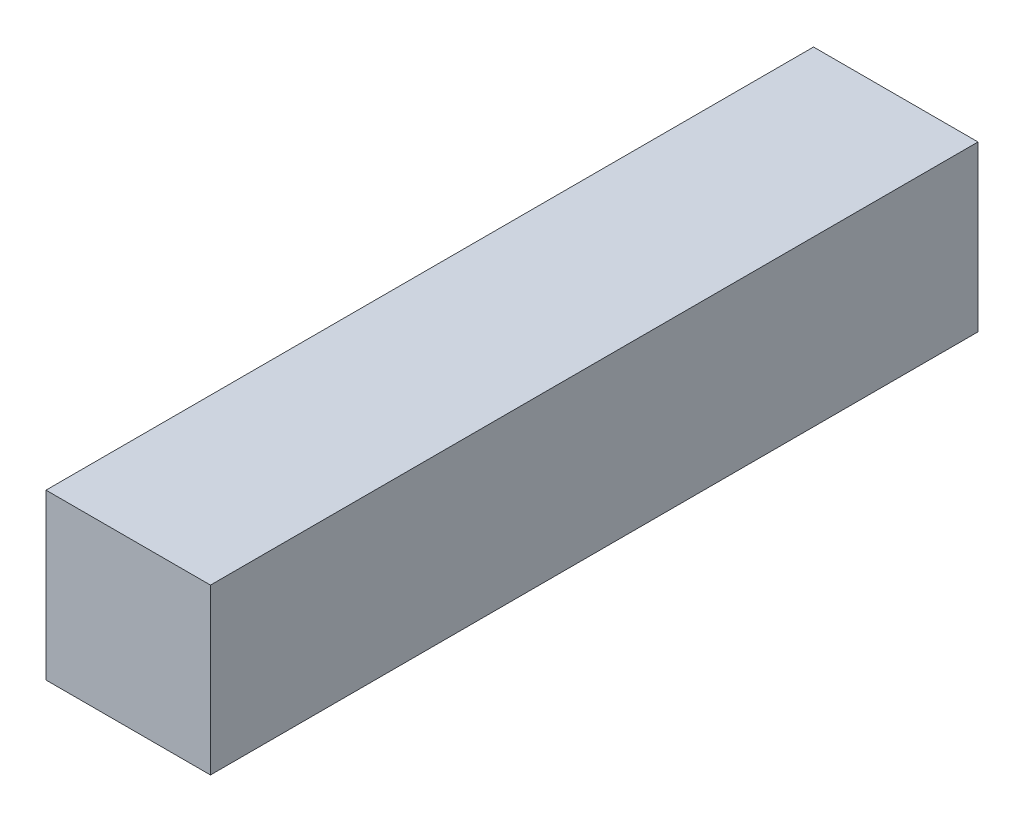
from build123d import *

# Parameters (mm, degrees)
SKETCH1_W           = 3
SKETCH1_H           = 3
BOSS_EXTRUDE1_DEPTH = 14


with BuildPart() as part:
    # Sketch1 → Boss-Extrude1 (new body)
    with BuildSketch(Plane.XY):
        Rectangle(SKETCH1_W, SKETCH1_H)
    extrude(amount=BOSS_EXTRUDE1_DEPTH)


solid = part.part
